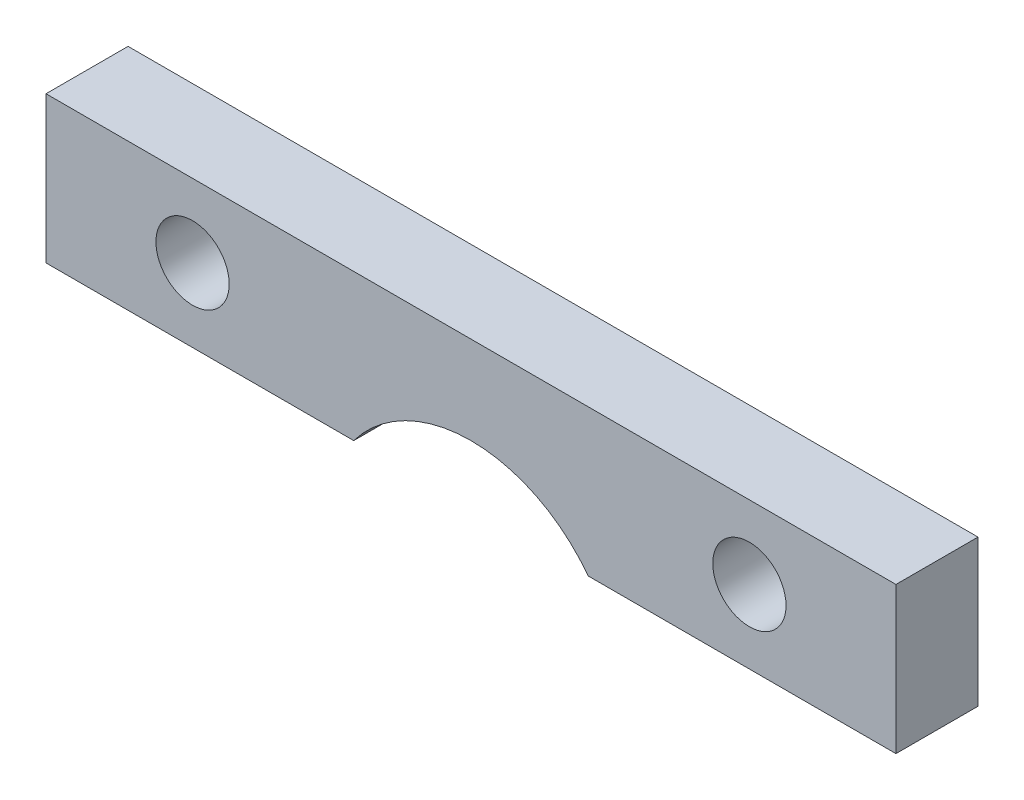
from build123d import *

# Parameters (mm, degrees)
SKETCH1_R           = 3.175
BOSS_EXTRUDE1_DEPTH = 7.112


with BuildPart() as part:
    # Sketch1 → Boss-Extrude1 (new body)
    with BuildSketch(Plane.XY):
        with BuildLine():
            Line((46.99, 0), (73.66, 0))
            Line((73.66, 0), (73.66, 12.7))
            Line((73.66, 12.7), (0, 12.7))
            Line((0, 12.7), (0, 0))
            Line((0, 0), (26.67, 0))
            ThreePointArc((26.67, 0), (36.83, 5.08), (46.99, 0))
        make_face()
        with Locations((12.7, 6.35)):
            Circle(SKETCH1_R, mode=Mode.SUBTRACT)
        with Locations((60.96, 6.35)):
            Circle(SKETCH1_R, mode=Mode.SUBTRACT)
    extrude(amount=BOSS_EXTRUDE1_DEPTH)


solid = part.part
